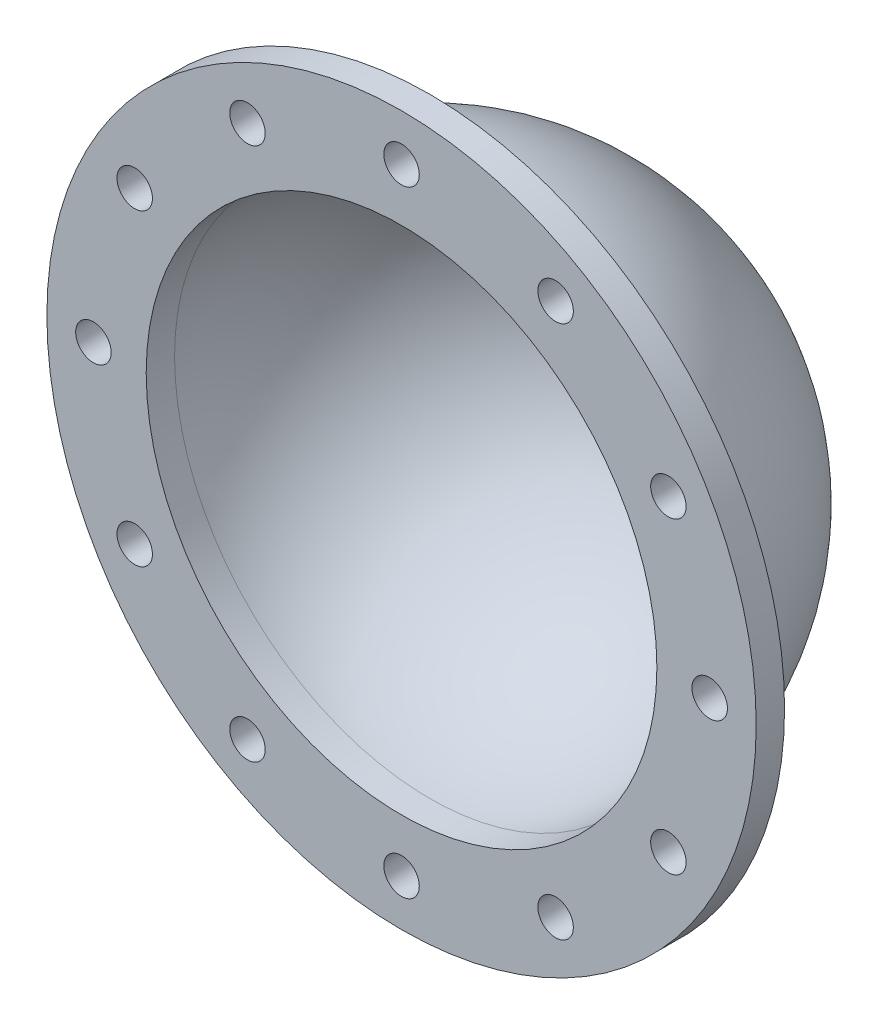
from build123d import *

# Parameters (mm, degrees)
SKETCH1_R           = 250
SKETCH1_R_2         = 180
SKETCH1_R_3         = 12.5
BOSS_EXTRUDE2_DEPTH = 20
REVOLVE1_ANGLE      = 180


with BuildPart() as part:
    # Sketch1 → Boss-Extrude2 (new body)
    with BuildSketch(Plane.XY):
        Circle(SKETCH1_R)
        Circle(SKETCH1_R_2, mode=Mode.SUBTRACT)
        with Locations((0, 217.200097765)):
            Circle(SKETCH1_R_3, mode=Mode.SUBTRACT)
        with Locations((108.600048882, 188.100802369)):
            Circle(SKETCH1_R_3, mode=Mode.SUBTRACT)
        with Locations((188.100802369, 108.600048882)):
            Circle(SKETCH1_R_3, mode=Mode.SUBTRACT)
        with Locations((217.200097765, 0)):
            Circle(SKETCH1_R_3, mode=Mode.SUBTRACT)
        with Locations((188.100802369, -108.600048882)):
            Circle(SKETCH1_R_3, mode=Mode.SUBTRACT)
        with Locations((108.600048882, -188.100802369)):
            Circle(SKETCH1_R_3, mode=Mode.SUBTRACT)
        with Locations((0, -217.200097765)):
            Circle(SKETCH1_R_3, mode=Mode.SUBTRACT)
        with Locations((-108.600048882, -188.100802369)):
            Circle(SKETCH1_R_3, mode=Mode.SUBTRACT)
        with Locations((-188.100802369, -108.600048882)):
            Circle(SKETCH1_R_3, mode=Mode.SUBTRACT)
        with Locations((-217.200097765, 0)):
            Circle(SKETCH1_R_3, mode=Mode.SUBTRACT)
        with Locations((-188.100802369, 108.600048882)):
            Circle(SKETCH1_R_3, mode=Mode.SUBTRACT)
        with Locations((-108.600048882, 188.100802369)):
            Circle(SKETCH1_R_3, mode=Mode.SUBTRACT)
    extrude(amount=BOSS_EXTRUDE2_DEPTH)

    # Sketch2 → Revolve1 (revolve)
    with BuildSketch(Plane(origin=(0, 0, 0), x_dir=(-1, 0, 0), z_dir=(0, 0, -1))):
        with BuildLine():
            Line((0, 180), (0, 200))
            ThreePointArc((0, 200), (200, 0), (0, -200))
            Line((0, -200), (0, -180))
            ThreePointArc((0, -180), (180, 0), (0, 180))
        make_face()
    revolve(axis=Axis((0, 180, 0), (0, -1, 0)), revolution_arc=REVOLVE1_ANGLE)


solid = part.part
